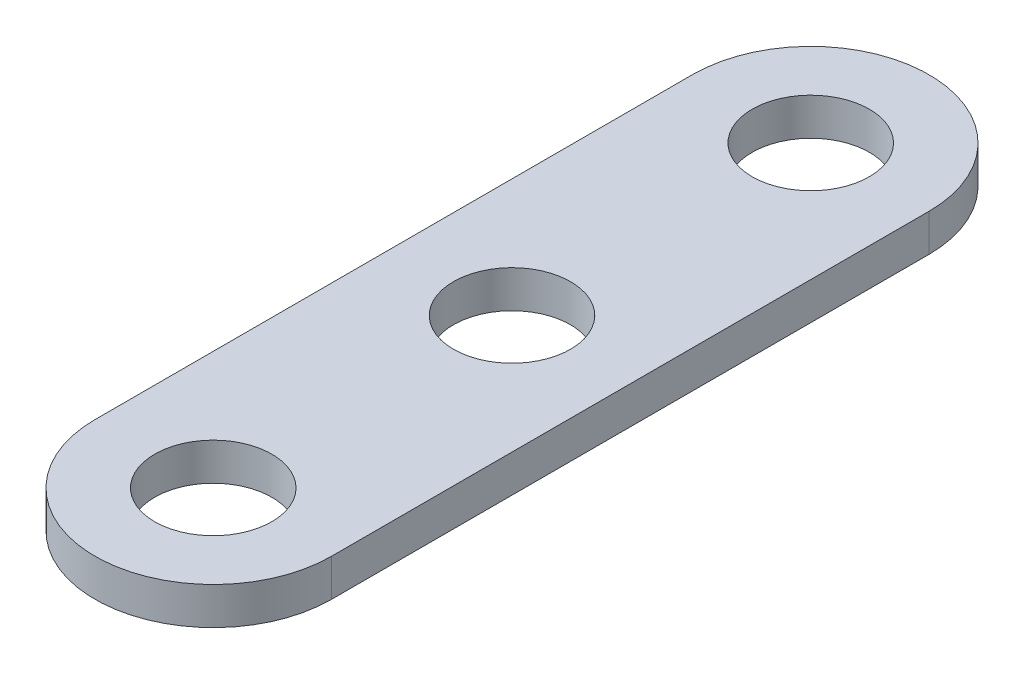
from build123d import *

# Parameters (mm, degrees)
SKETCH1_R           = 2.4892
BOSS_EXTRUDE1_DEPTH = 1.5875


with BuildPart() as part:
    # Sketch1 → Boss-Extrude1 (new body)
    with BuildSketch(Plane(origin=(0, 0, 0), x_dir=(1, 0, 0), z_dir=(0, 1, 0))):
        with BuildLine():
            Line((5.0292, -12.7), (5.0292, 12.7))
            ThreePointArc((5.0292, 12.7), (0, 17.7292), (-5.0292, 12.7))
            Line((-5.0292, 12.7), (-5.0292, -12.7))
            ThreePointArc((-5.0292, -12.7), (0, -17.7292), (5.0292, -12.7))
        make_face()
        with Locations(Location((0, 0, 0), (0, 0, 270))):
            Circle(SKETCH1_R, mode=Mode.SUBTRACT)
        with Locations(Location((0, 12.7, 0), (0, 0, 270))):
            Circle(SKETCH1_R, mode=Mode.SUBTRACT)
        with Locations(Location((0, -12.7, 0), (0, 0, 270))):
            Circle(SKETCH1_R, mode=Mode.SUBTRACT)
    extrude(amount=BOSS_EXTRUDE1_DEPTH)


solid = part.part
